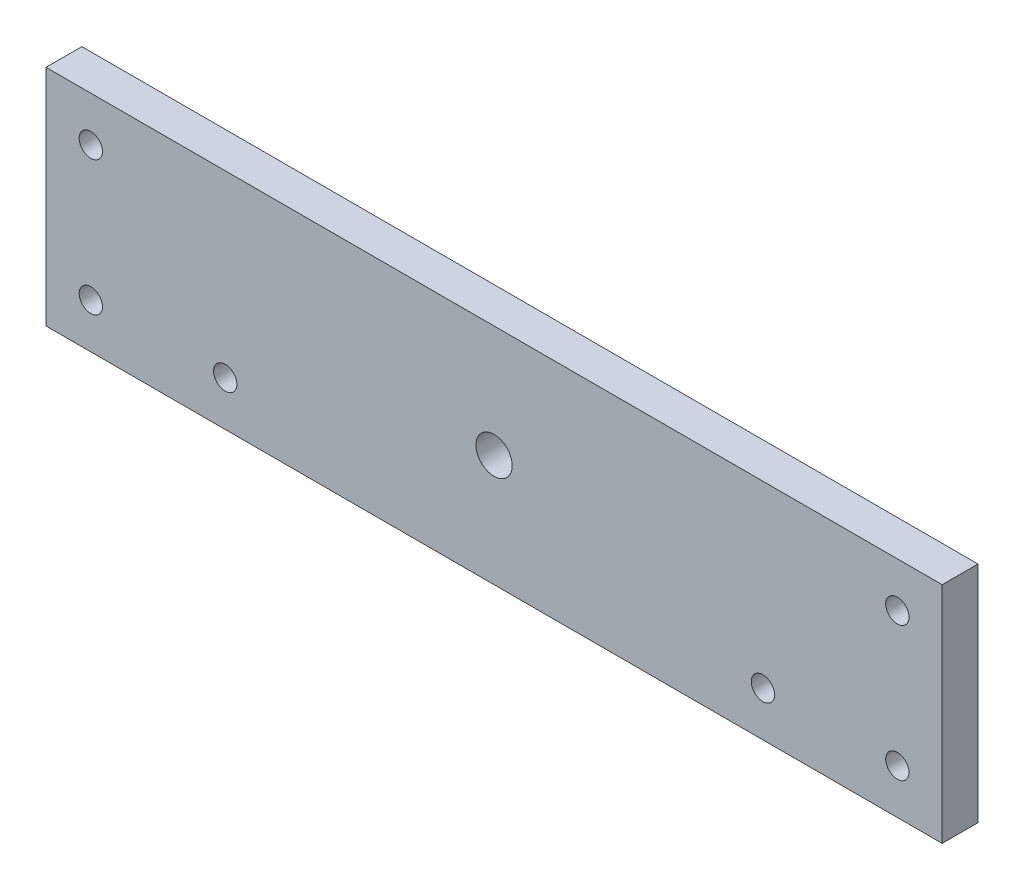
from build123d import *

# Parameters (mm, degrees)
IZIM1_W                              = 200
IZIM1_H                              = 50
Y_KSEKLIK_EKSTR_ZYON1_DEPTH          = 8
M5_HELISARMAL_I_IN_Z_VANA_MATKAB_1_D = 5.2
M5_HELISARMAL_I_IN_Z_VANA_MATKAB_2_D = 5.2
KES_EKSTR_ZYON1_DEPTH                = 10


with BuildPart() as part:
    # Çizim1 → Yükseklik-Ekstrüzyon1 (new body)
    with BuildSketch(Plane.XY):
        with Locations((11.855409505, 24.184782609)):
            Rectangle(IZIM1_W, IZIM1_H)
    extrude(amount=Y_KSEKLIK_EKSTR_ZYON1_DEPTH)

    # M5 Helisarmal için Zıvana matkabı1 (through all)
    with Locations(Plane(origin=(0, 0, 0), x_dir=(-1, 0, 0), z_dir=(0, 0, -1))):
        with Locations((-101.855409505, 39.184782609), (-101.855409505, 9.184782609), (78.144590495, 9.184782609), (78.144590495, 39.184782609)):
            Hole(M5_HELISARMAL_I_IN_Z_VANA_MATKAB_1_D / 2)

    # M5 Helisarmal için Zıvana matkabı2 (through all)
    with Locations(Plane(origin=(71.855409505, 9.184782609, 0), x_dir=(-1, 0, 0), z_dir=(0, 0, -1))):
        with Locations((0, 0), (120, 0)):
            Hole(M5_HELISARMAL_I_IN_Z_VANA_MATKAB_2_D / 2)

    # Çizim8 → Kes-Ekstrüzyon1 (cut)
    with BuildSketch(Plane(origin=(0, 0, 0), x_dir=(-1, 0, 0), z_dir=(0, 0, -1))):
        with BuildLine():
            ThreePointArc((-7.805409505, 24.184782609), (-8.991627041, 27.048565073), (-11.855409505, 28.234782609))
            Line((-11.855409505, 28.234782609), (-11.855409505, 20.134782609))
            ThreePointArc((-11.855409505, 20.134782609), (-8.991627041, 21.321000145), (-7.805409505, 24.184782609))
        make_face()
        with BuildLine():
            Line((-11.855409505, 20.134782609), (-11.855409505, 28.234782609))
            ThreePointArc((-11.855409505, 28.234782609), (-15.905409505, 24.184782609), (-11.855409505, 20.134782609))
        make_face()
    extrude(amount=-KES_EKSTR_ZYON1_DEPTH, mode=Mode.SUBTRACT)


solid = part.part
